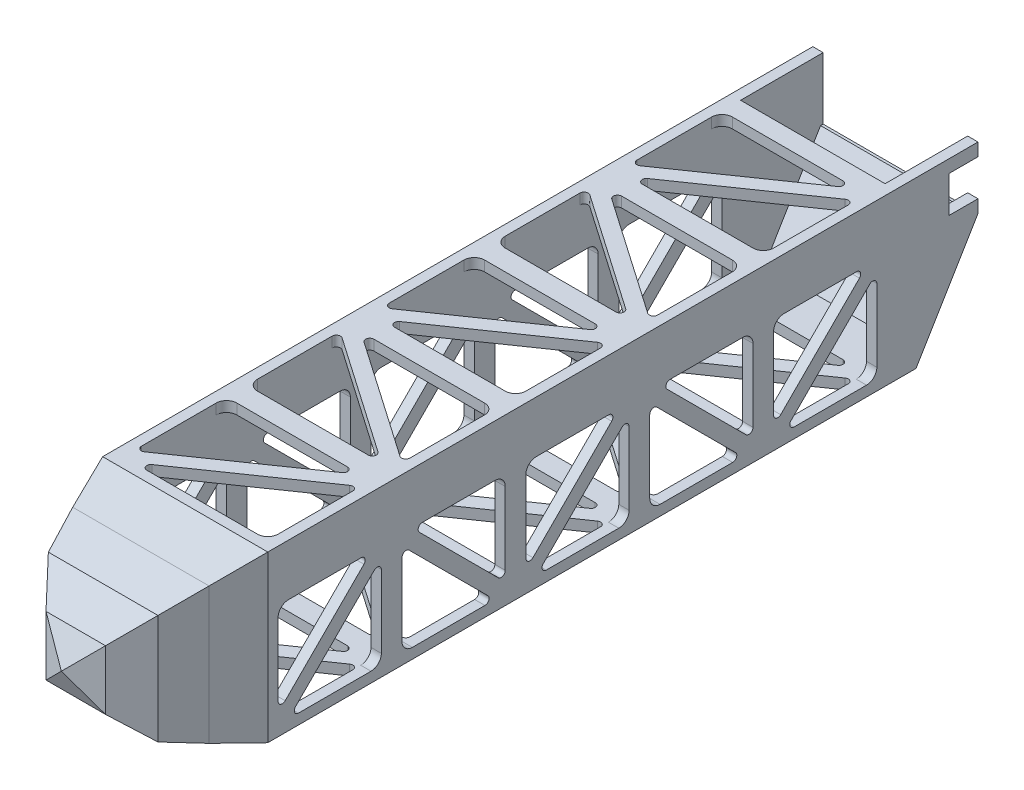
from build123d import *

# Parameters (mm, degrees)
SKETCH1_W           = 101.6
SKETCH1_H           = 101.6
BOSS_EXTRUDE1_DEPTH = 436.88
SHELL1_T            = -6.35
CUT_EXTRUDE2_DEPTH  = 526.503840631
BOSS_EXTRUDE2_DEPTH = 101.6
SKETCH12_W          = 88.9
SKETCH12_H          = 38.1
CUT_EXTRUDE3_DEPTH  = 50.8
CUT_EXTRUDE5_REACH  = 527.504
SKETCH15_W          = 17.78
SKETCH15_H          = 22.352
CUT_EXTRUDE6_REACH  = 527.504
CUT_EXTRUDE9_REACH  = 527.504


with BuildPart() as part:
    # Sketch1 → Boss-Extrude1 (new body)
    with BuildSketch(Plane.XY):
        Rectangle(SKETCH1_W, SKETCH1_H)
    extrude(amount=BOSS_EXTRUDE1_DEPTH)

    # Sketch5 → Loft2 section 0
    with BuildSketch(Plane.XY.offset(436.88)):
        with BuildLine():
            Line((50.8, -50.8), (50.8, 50.8))
            Line((50.8, 50.8), (-50.8, 50.8))
            Line((-50.8, 50.8), (-50.8, -50.8))
            Line((-50.8, -50.8), (50.8, -50.8))
        make_face()
    # Sketch3 → Loft2 section 1
    with BuildSketch(Plane.XY.offset(464.156588322)):
        with BuildLine():
            Line((-41.937305, -41.937305), (41.937305, -41.937305))
            Line((41.937305, -41.937305), (41.937305, 41.937305))
            Line((41.937305, 41.937305), (-41.937305, 41.937305))
            Line((-41.937305, 41.937305), (-41.937305, -41.937305))
        make_face()
    loft()

    # Sketch3<6> → Loft3 section 0
    with BuildSketch(Plane.XY.offset(464.156588322)):
        with BuildLine():
            Line((-41.937305, -41.937305), (41.937305, -41.937305))
            Line((41.937305, -41.937305), (41.937305, 41.937305))
            Line((41.937305, 41.937305), (-41.937305, 41.937305))
            Line((-41.937305, 41.937305), (-41.937305, -41.937305))
        make_face()
    # Sketch6 → Loft3 section 1
    with BuildSketch(Plane.XY.offset(487.359440316)):
        with BuildLine():
            Line((-33.71596, -33.71596), (33.71596, -33.71596))
            Line((33.71596, -33.71596), (33.71596, 33.71596))
            Line((33.71596, 33.71596), (-33.71596, 33.71596))
            Line((-33.71596, 33.71596), (-33.71596, -33.71596))
        make_face()
    loft()

    # Sketch6<4> → Loft4 section 0
    with BuildSketch(Plane.XY.offset(487.359440316)):
        with BuildLine():
            Line((-33.71596, -33.71596), (33.71596, -33.71596))
            Line((33.71596, -33.71596), (33.71596, 33.71596))
            Line((33.71596, 33.71596), (-33.71596, 33.71596))
            Line((-33.71596, 33.71596), (-33.71596, -33.71596))
        make_face()
    # Sketch7 → Loft4 section 1
    with BuildSketch(Plane.XY.offset(504.217299158)):
        with BuildLine():
            Line((-18.304143458, -18.304143458), (18.304143458, -18.304143458))
            Line((18.304143458, -18.304143458), (18.304143458, 18.304143458))
            Line((18.304143458, 18.304143458), (-18.304143458, 18.304143458))
            Line((-18.304143458, 18.304143458), (-18.304143458, -18.304143458))
        make_face()
    loft()

    # Sketch7<5> → Loft5 section 0
    with BuildSketch(Plane.XY.offset(504.217299158), mode=Mode.PRIVATE) as loft5_s0:
        with BuildLine():
            Line((-18.304143458, -18.304143458), (18.304143458, -18.304143458))
            Line((18.304143458, -18.304143458), (18.304143458, 18.304143458))
            Line((18.304143458, 18.304143458), (-18.304143458, 18.304143458))
            Line((-18.304143458, 18.304143458), (-18.304143458, -18.304143458))
        make_face()
    loft([Vertex(0, 0, 513.079999985), loft5_s0.sketch])

    # Shell1
    shell1_openings = [part.faces().sort_by_distance(p)[0] for p in [
        (0, 0, 0),
    ]]
    offset(amount=SHELL1_T, openings=shell1_openings, kind=Kind.INTERSECTION)

    # Sketch10 → Cut-Extrude2 (cut, through all)
    with BuildSketch(Plane(origin=(50.8, 0, 0), x_dir=(0, 0, -1), z_dir=(1, 0, 0))):
        Polygon((0, -50.8), (0, 12.7), (-38.1, -50.8), align=None)
    extrude(amount=-CUT_EXTRUDE2_DEPTH, mode=Mode.SUBTRACT)

    # Sketch11 → Boss-Extrude2 (add)
    with BuildSketch(Plane(origin=(50.8, 0, 0), x_dir=(0, 0, -1), z_dir=(1, 0, 0))):
        Polygon((-38.1, -50.8), (-39.6875, -50.8), (-1.5875, 12.7), (-1.5875, 50.8), (0, 50.8), (0, 12.7), align=None)
    extrude(amount=-BOSS_EXTRUDE2_DEPTH)

    # Sketch12 → Cut-Extrude3 (cut)
    with BuildSketch(Plane(origin=(0, 0, 0), x_dir=(-1, 0, 0), z_dir=(0, 0, -1))):
        with Locations((0, 31.75)):
            Rectangle(SKETCH12_W, SKETCH12_H)
    extrude(amount=-CUT_EXTRUDE3_DEPTH, mode=Mode.SUBTRACT)

    # Sketch15 → Cut-Extrude5 (cut, up to next)
    with BuildSketch(Plane(origin=(50.8, 0, 0), x_dir=(0, 0, -1), z_dir=(1, 0, 0)), mode=Mode.PRIVATE) as cut_extrude5_sk1:
        with Locations((-8.89, 31.75)):
            Rectangle(SKETCH15_W, SKETCH15_H)
    cut_extrude5_tool1 = extrude(cut_extrude5_sk1.sketch, amount=-CUT_EXTRUDE5_REACH, mode=Mode.PRIVATE) & part.part
    add(cut_extrude5_tool1.solids().sort_by_distance((50.8, 31.75, 8.89))[0], mode=Mode.SUBTRACT)

    # Cut-Extrude6: up to this face of the body (flat: up to its plane)
    cut_extrude6_end = Plane(part.part.faces().sort_by_distance((-50.8, 0.830220396, 224.204101606))[0])
    # Sketch16 → Cut-Extrude6 (cut, up to the picked face)
    with BuildSketch(Plane(origin=(50.8, 0, 0), x_dir=(0, 0, -1), z_dir=(1, 0, 0)), mode=Mode.PRIVATE) as cut_extrude6_sk1:
        with BuildLine():
            Line((-379.512102448, 19.05), (-424.18, 19.05))
            ThreePointArc((-424.18, 19.05), (-428.670128061, 17.190128061), (-430.53, 12.7))
            Line((-430.53, 12.7), (-430.53, -31.967897552))
            ThreePointArc((-430.53, -31.967897552), (-428.962015918, -34.314551564), (-426.193948776, -33.763948776))
            Line((-426.193948776, -33.763948776), (-377.716051224, 14.713948776))
            ThreePointArc((-377.716051224, 14.713948776), (-377.165448436, 17.482015918), (-379.512102448, 19.05))
        make_face()
    cut_extrude6_tool1 = split(extrude(cut_extrude6_sk1.sketch, amount=-CUT_EXTRUDE6_REACH, mode=Mode.PRIVATE), bisect_by=cut_extrude6_end, keep=Keep.BOTH, mode=Mode.PRIVATE)
    # Sketch16 → Cut-Extrude6 (cut, up to the picked face)
    with BuildSketch(Plane(origin=(50.8, 0, 0), x_dir=(0, 0, -1), z_dir=(1, 0, 0)), mode=Mode.PRIVATE) as cut_extrude6_sk2:
        with BuildLine():
            ThreePointArc((-419.843948776, -40.113948776), (-420.394551564, -42.882015918), (-418.047897552, -44.45))
            Line((-418.047897552, -44.45), (-373.38, -44.45))
            ThreePointArc((-373.38, -44.45), (-368.889871939, -42.590128061), (-367.03, -38.1))
            Line((-367.03, -38.1), (-367.03, 6.567897552))
            ThreePointArc((-367.03, 6.567897552), (-368.597984082, 8.914551564), (-371.366051224, 8.363948776))
            Line((-371.366051224, 8.363948776), (-419.843948776, -40.113948776))
        make_face()
    cut_extrude6_tool2 = split(extrude(cut_extrude6_sk2.sketch, amount=-CUT_EXTRUDE6_REACH, mode=Mode.PRIVATE), bisect_by=cut_extrude6_end, keep=Keep.BOTH, mode=Mode.PRIVATE)
    # Sketch16 → Cut-Extrude6 (cut, up to the picked face)
    with BuildSketch(Plane(origin=(50.8, 0, 0), x_dir=(0, 0, -1), z_dir=(1, 0, 0)), mode=Mode.PRIVATE) as cut_extrude6_sk3:
        with BuildLine():
            ThreePointArc((-349.993948776, 8.363948776), (-352.762015918, 8.914551564), (-354.33, 6.567897552))
            Line((-354.33, 6.567897552), (-354.33, -38.1))
            ThreePointArc((-354.33, -38.1), (-352.470128061, -42.590128061), (-347.98, -44.45))
            Line((-347.98, -44.45), (-303.312102448, -44.45))
            ThreePointArc((-303.312102448, -44.45), (-300.965448436, -42.882015918), (-301.516051224, -40.113948776))
            Line((-301.516051224, -40.113948776), (-349.993948776, 8.363948776))
        make_face()
    cut_extrude6_tool3 = split(extrude(cut_extrude6_sk3.sketch, amount=-CUT_EXTRUDE6_REACH, mode=Mode.PRIVATE), bisect_by=cut_extrude6_end, keep=Keep.BOTH, mode=Mode.PRIVATE)
    # Sketch16 → Cut-Extrude6 (cut, up to the picked face)
    with BuildSketch(Plane(origin=(50.8, 0, 0), x_dir=(0, 0, -1), z_dir=(1, 0, 0)), mode=Mode.PRIVATE) as cut_extrude6_sk4:
        with BuildLine():
            Line((-297.18, 19.05), (-341.847897552, 19.05))
            ThreePointArc((-341.847897552, 19.05), (-344.194551564, 17.482015918), (-343.643948776, 14.713948776))
            Line((-343.643948776, 14.713948776), (-295.166051224, -33.763948776))
            ThreePointArc((-295.166051224, -33.763948776), (-292.397984082, -34.314551564), (-290.83, -31.967897552))
            Line((-290.83, -31.967897552), (-290.83, 12.7))
            ThreePointArc((-290.83, 12.7), (-292.689871939, 17.190128061), (-297.18, 19.05))
        make_face()
    cut_extrude6_tool4 = split(extrude(cut_extrude6_sk4.sketch, amount=-CUT_EXTRUDE6_REACH, mode=Mode.PRIVATE), bisect_by=cut_extrude6_end, keep=Keep.BOTH, mode=Mode.PRIVATE)
    # Sketch16 → Cut-Extrude6 (cut, up to the picked face)
    with BuildSketch(Plane(origin=(50.8, 0, 0), x_dir=(0, 0, -1), z_dir=(1, 0, 0)), mode=Mode.PRIVATE) as cut_extrude6_sk5:
        with BuildLine():
            ThreePointArc((-271.78, 19.05), (-276.270128061, 17.190128061), (-278.13, 12.7))
            Line((-278.13, 12.7), (-278.13, -31.967897552))
            ThreePointArc((-278.13, -31.967897552), (-276.562015918, -34.314551564), (-273.793948776, -33.763948776))
            Line((-273.793948776, -33.763948776), (-225.316051224, 14.713948776))
            ThreePointArc((-225.316051224, 14.713948776), (-224.765448436, 17.482015918), (-227.112102448, 19.05))
            Line((-227.112102448, 19.05), (-271.78, 19.05))
        make_face()
    cut_extrude6_tool5 = split(extrude(cut_extrude6_sk5.sketch, amount=-CUT_EXTRUDE6_REACH, mode=Mode.PRIVATE), bisect_by=cut_extrude6_end, keep=Keep.BOTH, mode=Mode.PRIVATE)
    # Sketch16 → Cut-Extrude6 (cut, up to the picked face)
    with BuildSketch(Plane(origin=(50.8, 0, 0), x_dir=(0, 0, -1), z_dir=(1, 0, 0)), mode=Mode.PRIVATE) as cut_extrude6_sk6:
        with BuildLine():
            Line((-214.63, -38.1), (-214.63, 6.567897552))
            ThreePointArc((-214.63, 6.567897552), (-216.197984082, 8.914551564), (-218.966051224, 8.363948776))
            Line((-218.966051224, 8.363948776), (-267.443948776, -40.113948776))
            ThreePointArc((-267.443948776, -40.113948776), (-267.994551564, -42.882015918), (-265.647897552, -44.45))
            Line((-265.647897552, -44.45), (-220.98, -44.45))
            ThreePointArc((-220.98, -44.45), (-216.489871939, -42.590128061), (-214.63, -38.1))
        make_face()
    cut_extrude6_tool6 = split(extrude(cut_extrude6_sk6.sketch, amount=-CUT_EXTRUDE6_REACH, mode=Mode.PRIVATE), bisect_by=cut_extrude6_end, keep=Keep.BOTH, mode=Mode.PRIVATE)
    # Sketch16 → Cut-Extrude6 (cut, up to the picked face)
    with BuildSketch(Plane(origin=(50.8, 0, 0), x_dir=(0, 0, -1), z_dir=(1, 0, 0)), mode=Mode.PRIVATE) as cut_extrude6_sk7:
        with BuildLine():
            ThreePointArc((-197.593948776, 8.363948776), (-200.362015918, 8.914551564), (-201.93, 6.567897552))
            Line((-201.93, 6.567897552), (-201.93, -38.1))
            ThreePointArc((-201.93, -38.1), (-200.070128061, -42.590128061), (-195.58, -44.45))
            Line((-195.58, -44.45), (-150.912102448, -44.45))
            ThreePointArc((-150.912102448, -44.45), (-148.565448436, -42.882015918), (-149.116051224, -40.113948776))
            Line((-149.116051224, -40.113948776), (-197.593948776, 8.363948776))
        make_face()
    cut_extrude6_tool7 = split(extrude(cut_extrude6_sk7.sketch, amount=-CUT_EXTRUDE6_REACH, mode=Mode.PRIVATE), bisect_by=cut_extrude6_end, keep=Keep.BOTH, mode=Mode.PRIVATE)
    # Sketch16 → Cut-Extrude6 (cut, up to the picked face)
    with BuildSketch(Plane(origin=(50.8, 0, 0), x_dir=(0, 0, -1), z_dir=(1, 0, 0)), mode=Mode.PRIVATE) as cut_extrude6_sk8:
        with BuildLine():
            Line((-144.78, 19.05), (-189.447897552, 19.05))
            ThreePointArc((-189.447897552, 19.05), (-191.794551564, 17.482015918), (-191.243948776, 14.713948776))
            Line((-191.243948776, 14.713948776), (-142.766051224, -33.763948776))
            ThreePointArc((-142.766051224, -33.763948776), (-139.997984082, -34.314551564), (-138.43, -31.967897552))
            Line((-138.43, -31.967897552), (-138.43, 12.7))
            ThreePointArc((-138.43, 12.7), (-140.289871939, 17.190128061), (-144.78, 19.05))
        make_face()
    cut_extrude6_tool8 = split(extrude(cut_extrude6_sk8.sketch, amount=-CUT_EXTRUDE6_REACH, mode=Mode.PRIVATE), bisect_by=cut_extrude6_end, keep=Keep.BOTH, mode=Mode.PRIVATE)
    # Sketch16 → Cut-Extrude6 (cut, up to the picked face)
    with BuildSketch(Plane(origin=(50.8, 0, 0), x_dir=(0, 0, -1), z_dir=(1, 0, 0)), mode=Mode.PRIVATE) as cut_extrude6_sk9:
        with BuildLine():
            ThreePointArc((-119.38, 19.05), (-123.870128061, 17.190128061), (-125.73, 12.7))
            Line((-125.73, 12.7), (-125.73, -31.967897552))
            ThreePointArc((-125.73, -31.967897552), (-124.162015918, -34.314551564), (-121.393948776, -33.763948776))
            Line((-121.393948776, -33.763948776), (-72.916051224, 14.713948776))
            ThreePointArc((-72.916051224, 14.713948776), (-72.365448436, 17.482015918), (-74.712102448, 19.05))
            Line((-74.712102448, 19.05), (-119.38, 19.05))
        make_face()
    cut_extrude6_tool9 = split(extrude(cut_extrude6_sk9.sketch, amount=-CUT_EXTRUDE6_REACH, mode=Mode.PRIVATE), bisect_by=cut_extrude6_end, keep=Keep.BOTH, mode=Mode.PRIVATE)
    # Sketch16 → Cut-Extrude6 (cut, up to the picked face)
    with BuildSketch(Plane(origin=(50.8, 0, 0), x_dir=(0, 0, -1), z_dir=(1, 0, 0)), mode=Mode.PRIVATE) as cut_extrude6_sk10:
        with BuildLine():
            Line((-62.23, -38.1), (-62.23, 6.567897552))
            ThreePointArc((-62.23, 6.567897552), (-63.797984082, 8.914551564), (-66.566051224, 8.363948776))
            Line((-66.566051224, 8.363948776), (-115.043948776, -40.113948776))
            ThreePointArc((-115.043948776, -40.113948776), (-115.594551564, -42.882015918), (-113.247897552, -44.45))
            Line((-113.247897552, -44.45), (-68.58, -44.45))
            ThreePointArc((-68.58, -44.45), (-64.089871939, -42.590128061), (-62.23, -38.1))
        make_face()
    cut_extrude6_tool10 = split(extrude(cut_extrude6_sk10.sketch, amount=-CUT_EXTRUDE6_REACH, mode=Mode.PRIVATE), bisect_by=cut_extrude6_end, keep=Keep.BOTH, mode=Mode.PRIVATE)
    add(cut_extrude6_tool1.solids().sort_by(Axis((50.8, -0.008317, 411.471683), (-1, 0, 0)))[0], mode=Mode.SUBTRACT)
    add(cut_extrude6_tool2.solids().sort_by(Axis((50.8, -25.391683, 386.088317), (-1, 0, 0)))[0], mode=Mode.SUBTRACT)
    add(cut_extrude6_tool3.solids().sort_by(Axis((50.8, -25.391683, 335.271683), (-1, 0, 0)))[0], mode=Mode.SUBTRACT)
    add(cut_extrude6_tool4.solids().sort_by(Axis((50.8, -0.008317, 309.888317), (-1, 0, 0)))[0], mode=Mode.SUBTRACT)
    add(cut_extrude6_tool5.solids().sort_by(Axis((50.8, -0.008317, 259.071683), (-1, 0, 0)))[0], mode=Mode.SUBTRACT)
    add(cut_extrude6_tool6.solids().sort_by(Axis((50.8, -25.391683, 233.688317), (-1, 0, 0)))[0], mode=Mode.SUBTRACT)
    add(cut_extrude6_tool7.solids().sort_by(Axis((50.8, -25.391683, 182.871683), (-1, 0, 0)))[0], mode=Mode.SUBTRACT)
    add(cut_extrude6_tool8.solids().sort_by(Axis((50.8, -0.008317, 157.488317), (-1, 0, 0)))[0], mode=Mode.SUBTRACT)
    add(cut_extrude6_tool9.solids().sort_by(Axis((50.8, -0.008317, 106.671683), (-1, 0, 0)))[0], mode=Mode.SUBTRACT)
    add(cut_extrude6_tool10.solids().sort_by(Axis((50.8, -25.391683, 81.288317), (-1, 0, 0)))[0], mode=Mode.SUBTRACT)

    # Cut-Extrude9: up to this face of the body (flat: up to its plane)
    cut_extrude9_end = Plane(part.part.faces().sort_by_distance((0, -50.8, 237.49))[0])
    # Sketch18 → Cut-Extrude9 (cut, up to the picked face)
    with BuildSketch(Plane(origin=(0, 50.8, 0), x_dir=(1, 0, 0), z_dir=(0, 1, 0)), mode=Mode.PRIVATE) as cut_extrude9_sk1:
        with BuildLine():
            Line((38.1, -430.53), (-29.968785968, -430.53))
            ThreePointArc((-29.968785968, -430.53), (-32.393250357, -428.747345646), (-31.414579315, -425.901631833))
            Line((-31.414579315, -425.901631833), (40.464206654, -376.139395394))
            ThreePointArc((40.464206654, -376.139395394), (43.088830968, -375.977884108), (44.45, -378.22776356))
            Line((44.45, -378.22776356), (44.45, -424.18))
            ThreePointArc((44.45, -424.18), (42.590128061, -428.670128061), (38.1, -430.53))
        make_face()
    cut_extrude9_tool1 = split(extrude(cut_extrude9_sk1.sketch, amount=-CUT_EXTRUDE9_REACH, mode=Mode.PRIVATE), bisect_by=cut_extrude9_end, keep=Keep.BOTH, mode=Mode.PRIVATE)
    # Sketch18 → Cut-Extrude9 (cut, up to the picked face)
    with BuildSketch(Plane(origin=(0, 50.8, 0), x_dir=(1, 0, 0), z_dir=(0, 1, 0)), mode=Mode.PRIVATE) as cut_extrude9_sk2:
        with BuildLine():
            Line((29.968785968, -367.03), (-38.1, -367.03))
            ThreePointArc((-38.1, -367.03), (-42.590128061, -368.889871939), (-44.45, -373.38))
            Line((-44.45, -373.38), (-44.45, -419.33223644))
            ThreePointArc((-44.45, -419.33223644), (-43.088830968, -421.582115892), (-40.464206654, -421.420604606))
            Line((-40.464206654, -421.420604606), (31.414579315, -371.658368167))
            ThreePointArc((31.414579315, -371.658368167), (32.393250357, -368.812654354), (29.968785968, -367.03))
        make_face()
    cut_extrude9_tool2 = split(extrude(cut_extrude9_sk2.sketch, amount=-CUT_EXTRUDE9_REACH, mode=Mode.PRIVATE), bisect_by=cut_extrude9_end, keep=Keep.BOTH, mode=Mode.PRIVATE)
    # Sketch18 → Cut-Extrude9 (cut, up to the picked face)
    with BuildSketch(Plane(origin=(0, 50.8, 0), x_dir=(1, 0, 0), z_dir=(0, 1, 0)), mode=Mode.PRIVATE) as cut_extrude9_sk3:
        with BuildLine():
            Line((-40.464206654, -299.939395394), (31.414579315, -349.701631833))
            ThreePointArc((31.414579315, -349.701631833), (32.393250357, -352.547345646), (29.968785968, -354.33))
            Line((29.968785968, -354.33), (-38.1, -354.33))
            ThreePointArc((-38.1, -354.33), (-42.590128061, -352.470128061), (-44.45, -347.98))
            Line((-44.45, -347.98), (-44.45, -302.02776356))
            ThreePointArc((-44.45, -302.02776356), (-43.088830968, -299.777884108), (-40.464206654, -299.939395394))
        make_face()
    cut_extrude9_tool3 = split(extrude(cut_extrude9_sk3.sketch, amount=-CUT_EXTRUDE9_REACH, mode=Mode.PRIVATE), bisect_by=cut_extrude9_end, keep=Keep.BOTH, mode=Mode.PRIVATE)
    # Sketch18 → Cut-Extrude9 (cut, up to the picked face)
    with BuildSketch(Plane(origin=(0, 50.8, 0), x_dir=(1, 0, 0), z_dir=(0, 1, 0)), mode=Mode.PRIVATE) as cut_extrude9_sk4:
        with BuildLine():
            Line((-29.968785968, -290.83), (38.1, -290.83))
            ThreePointArc((38.1, -290.83), (42.590128061, -292.689871939), (44.45, -297.18))
            Line((44.45, -297.18), (44.45, -343.13223644))
            ThreePointArc((44.45, -343.13223644), (43.088830968, -345.382115892), (40.464206654, -345.220604606))
            Line((40.464206654, -345.220604606), (-31.414579315, -295.458368167))
            ThreePointArc((-31.414579315, -295.458368167), (-32.393250357, -292.612654354), (-29.968785968, -290.83))
        make_face()
    cut_extrude9_tool4 = split(extrude(cut_extrude9_sk4.sketch, amount=-CUT_EXTRUDE9_REACH, mode=Mode.PRIVATE), bisect_by=cut_extrude9_end, keep=Keep.BOTH, mode=Mode.PRIVATE)
    # Sketch18 → Cut-Extrude9 (cut, up to the picked face)
    with BuildSketch(Plane(origin=(0, 50.8, 0), x_dir=(1, 0, 0), z_dir=(0, 1, 0)), mode=Mode.PRIVATE) as cut_extrude9_sk5:
        with BuildLine():
            Line((38.1, -278.13), (-29.968785968, -278.13))
            ThreePointArc((-29.968785968, -278.13), (-32.393250357, -276.347345646), (-31.414579315, -273.501631833))
            Line((-31.414579315, -273.501631833), (40.464206654, -223.739395394))
            ThreePointArc((40.464206654, -223.739395394), (43.088830968, -223.577884108), (44.45, -225.82776356))
            Line((44.45, -225.82776356), (44.45, -271.78))
            ThreePointArc((44.45, -271.78), (42.590128061, -276.270128061), (38.1, -278.13))
        make_face()
    cut_extrude9_tool5 = split(extrude(cut_extrude9_sk5.sketch, amount=-CUT_EXTRUDE9_REACH, mode=Mode.PRIVATE), bisect_by=cut_extrude9_end, keep=Keep.BOTH, mode=Mode.PRIVATE)
    # Sketch18 → Cut-Extrude9 (cut, up to the picked face)
    with BuildSketch(Plane(origin=(0, 50.8, 0), x_dir=(1, 0, 0), z_dir=(0, 1, 0)), mode=Mode.PRIVATE) as cut_extrude9_sk6:
        with BuildLine():
            Line((31.414579315, -219.258368167), (-40.464206654, -269.020604606))
            ThreePointArc((-40.464206654, -269.020604606), (-43.088830968, -269.182115892), (-44.45, -266.93223644))
            Line((-44.45, -266.93223644), (-44.45, -220.98))
            ThreePointArc((-44.45, -220.98), (-42.590128061, -216.489871939), (-38.1, -214.63))
            Line((-38.1, -214.63), (29.968785968, -214.63))
            ThreePointArc((29.968785968, -214.63), (32.393250357, -216.412654354), (31.414579315, -219.258368167))
        make_face()
    cut_extrude9_tool6 = split(extrude(cut_extrude9_sk6.sketch, amount=-CUT_EXTRUDE9_REACH, mode=Mode.PRIVATE), bisect_by=cut_extrude9_end, keep=Keep.BOTH, mode=Mode.PRIVATE)
    # Sketch18 → Cut-Extrude9 (cut, up to the picked face)
    with BuildSketch(Plane(origin=(0, 50.8, 0), x_dir=(1, 0, 0), z_dir=(0, 1, 0)), mode=Mode.PRIVATE) as cut_extrude9_sk7:
        with BuildLine():
            Line((-38.1, -201.93), (29.968785968, -201.93))
            ThreePointArc((29.968785968, -201.93), (32.393250357, -200.147345646), (31.414579315, -197.301631833))
            Line((31.414579315, -197.301631833), (-40.464206654, -147.539395394))
            ThreePointArc((-40.464206654, -147.539395394), (-43.088830968, -147.377884108), (-44.45, -149.62776356))
            Line((-44.45, -149.62776356), (-44.45, -195.58))
            ThreePointArc((-44.45, -195.58), (-42.590128061, -200.070128061), (-38.1, -201.93))
        make_face()
    cut_extrude9_tool7 = split(extrude(cut_extrude9_sk7.sketch, amount=-CUT_EXTRUDE9_REACH, mode=Mode.PRIVATE), bisect_by=cut_extrude9_end, keep=Keep.BOTH, mode=Mode.PRIVATE)
    # Sketch18 → Cut-Extrude9 (cut, up to the picked face)
    with BuildSketch(Plane(origin=(0, 50.8, 0), x_dir=(1, 0, 0), z_dir=(0, 1, 0)), mode=Mode.PRIVATE) as cut_extrude9_sk8:
        with BuildLine():
            Line((40.464206654, -192.820604606), (-31.414579315, -143.058368167))
            ThreePointArc((-31.414579315, -143.058368167), (-32.393250357, -140.212654354), (-29.968785968, -138.43))
            Line((-29.968785968, -138.43), (38.1, -138.43))
            ThreePointArc((38.1, -138.43), (42.590128061, -140.289871939), (44.45, -144.78))
            Line((44.45, -144.78), (44.45, -190.73223644))
            ThreePointArc((44.45, -190.73223644), (43.088830968, -192.982115892), (40.464206654, -192.820604606))
        make_face()
    cut_extrude9_tool8 = split(extrude(cut_extrude9_sk8.sketch, amount=-CUT_EXTRUDE9_REACH, mode=Mode.PRIVATE), bisect_by=cut_extrude9_end, keep=Keep.BOTH, mode=Mode.PRIVATE)
    # Sketch18 → Cut-Extrude9 (cut, up to the picked face)
    with BuildSketch(Plane(origin=(0, 50.8, 0), x_dir=(1, 0, 0), z_dir=(0, 1, 0)), mode=Mode.PRIVATE) as cut_extrude9_sk9:
        with BuildLine():
            Line((38.1, -125.73), (-29.968785968, -125.73))
            ThreePointArc((-29.968785968, -125.73), (-32.393250357, -123.947345646), (-31.414579315, -121.101631833))
            Line((-31.414579315, -121.101631833), (40.464206654, -71.339395394))
            ThreePointArc((40.464206654, -71.339395394), (43.088830968, -71.177884108), (44.45, -73.42776356))
            Line((44.45, -73.42776356), (44.45, -119.38))
            ThreePointArc((44.45, -119.38), (42.590128061, -123.870128061), (38.1, -125.73))
        make_face()
    cut_extrude9_tool9 = split(extrude(cut_extrude9_sk9.sketch, amount=-CUT_EXTRUDE9_REACH, mode=Mode.PRIVATE), bisect_by=cut_extrude9_end, keep=Keep.BOTH, mode=Mode.PRIVATE)
    # Sketch18 → Cut-Extrude9 (cut, up to the picked face)
    with BuildSketch(Plane(origin=(0, 50.8, 0), x_dir=(1, 0, 0), z_dir=(0, 1, 0)), mode=Mode.PRIVATE) as cut_extrude9_sk10:
        with BuildLine():
            Line((31.414579315, -66.858368167), (-40.464206654, -116.620604606))
            ThreePointArc((-40.464206654, -116.620604606), (-43.088830968, -116.782115892), (-44.45, -114.53223644))
            Line((-44.45, -114.53223644), (-44.45, -68.58))
            ThreePointArc((-44.45, -68.58), (-42.590128061, -64.089871939), (-38.1, -62.23))
            Line((-38.1, -62.23), (29.968785968, -62.23))
            ThreePointArc((29.968785968, -62.23), (32.393250357, -64.012654354), (31.414579315, -66.858368167))
        make_face()
    cut_extrude9_tool10 = split(extrude(cut_extrude9_sk10.sketch, amount=-CUT_EXTRUDE9_REACH, mode=Mode.PRIVATE), bisect_by=cut_extrude9_end, keep=Keep.BOTH, mode=Mode.PRIVATE)
    add(cut_extrude9_tool1.solids().sort_by(Axis((17.048995, 50.8, 411.401622), (0, -1, 0)))[0], mode=Mode.SUBTRACT)
    add(cut_extrude9_tool2.solids().sort_by(Axis((-17.048995, 50.8, 386.158378), (0, -1, 0)))[0], mode=Mode.SUBTRACT)
    add(cut_extrude9_tool3.solids().sort_by(Axis((-17.048995, 50.8, 335.201622), (0, -1, 0)))[0], mode=Mode.SUBTRACT)
    add(cut_extrude9_tool4.solids().sort_by(Axis((17.048995, 50.8, 309.958378), (0, -1, 0)))[0], mode=Mode.SUBTRACT)
    add(cut_extrude9_tool5.solids().sort_by(Axis((17.048995, 50.8, 259.001622), (0, -1, 0)))[0], mode=Mode.SUBTRACT)
    add(cut_extrude9_tool6.solids().sort_by(Axis((-17.048995, 50.8, 233.758378), (0, -1, 0)))[0], mode=Mode.SUBTRACT)
    add(cut_extrude9_tool7.solids().sort_by(Axis((-17.048995, 50.8, 182.801622), (0, -1, 0)))[0], mode=Mode.SUBTRACT)
    add(cut_extrude9_tool8.solids().sort_by(Axis((17.048995, 50.8, 157.558378), (0, -1, 0)))[0], mode=Mode.SUBTRACT)
    add(cut_extrude9_tool9.solids().sort_by(Axis((17.048995, 50.8, 106.601622), (0, -1, 0)))[0], mode=Mode.SUBTRACT)
    add(cut_extrude9_tool10.solids().sort_by(Axis((-17.048995, 50.8, 81.358378), (0, -1, 0)))[0], mode=Mode.SUBTRACT)


solid = part.part
